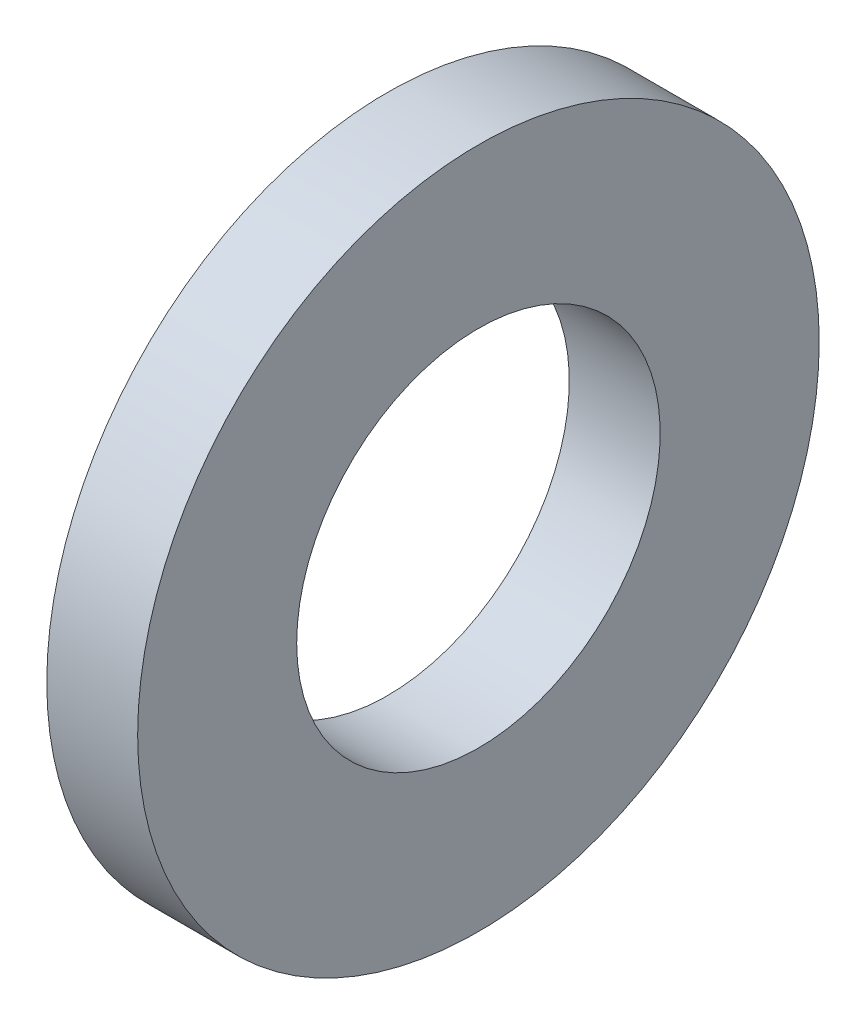
from build123d import *

# Parameters (mm, degrees)
SKETCH1_W = 2
SKETCH1_H = 3.5


with BuildPart() as part:
    # Sketch1 → Base-Revolve (revolve)
    with BuildSketch(Plane.XY, mode=Mode.PRIVATE) as base_revolve_sk:
        with Locations((-1, 5.75)):
            Rectangle(SKETCH1_W, SKETCH1_H)
    revolve(base_revolve_sk.sketch.rotate(Axis((-34.925, 0, 0), (1, 0, 0)), 90), axis=Axis((-34.925, 0, 0), (1, 0, 0)))


solid = part.part
